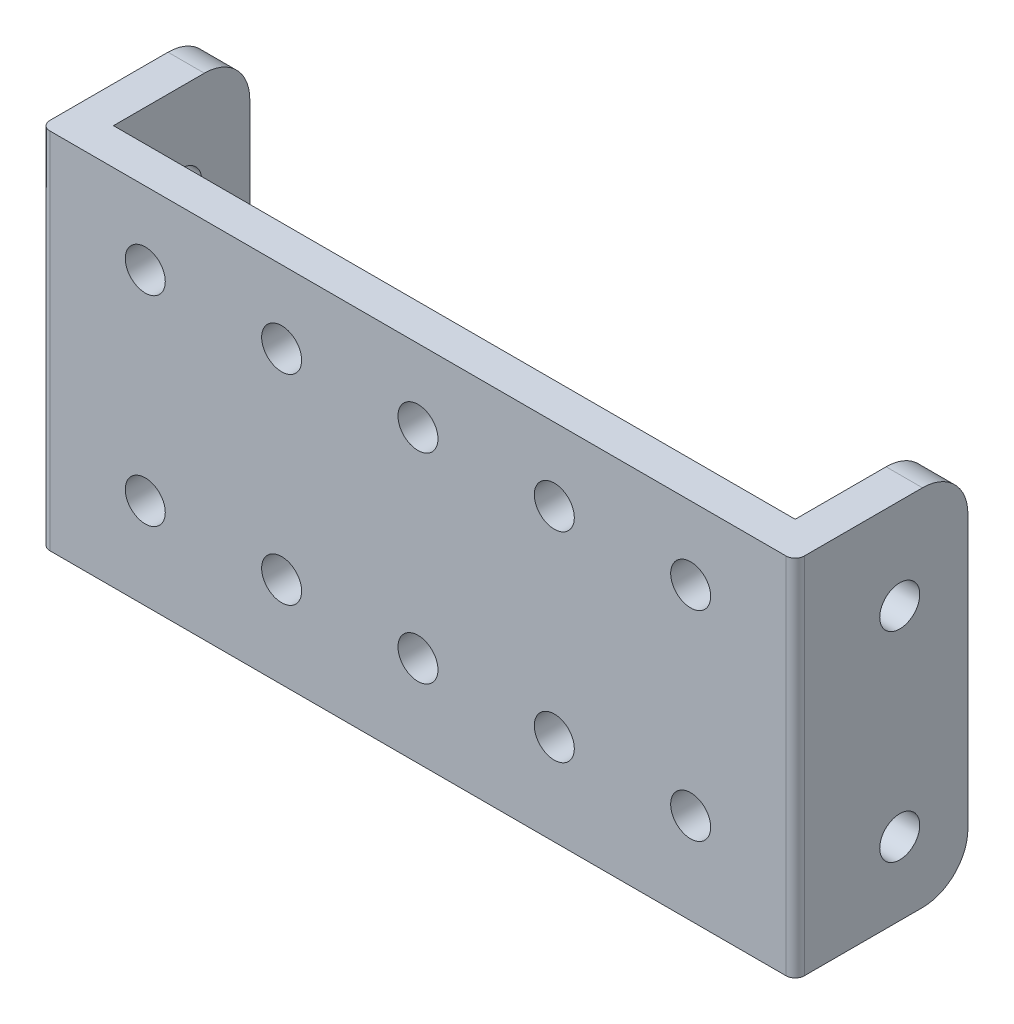
from build123d import *

# Parameters (mm, degrees)
BOSS_EXTRUDE1_DEPTH = 40
FILLET1_R           = 5
SKETCH2_R           = 2.2
CUT_EXTRUDE1_DEPTH  = 40
SKETCH3_R           = 2.2
CUT_EXTRUDE2_DEPTH  = 94


with BuildPart() as part:
    # Sketch1 → Boss-Extrude1 (new body)
    with BuildSketch(Plane(origin=(0, 0, 0), x_dir=(1, 0, 0), z_dir=(0, 1, 0))):
        with BuildLine():
            Line((36.5, 0), (-36.5, 0))
            Line((-36.5, 0), (-37.5, 0))
            Line((-37.5, 0), (-37.5, 1))
            Line((-37.5, 1), (-37.5, 15))
            Line((-37.5, 15), (-41.5, 15))
            Line((-41.5, 15), (-41.5, -3))
            ThreePointArc((-41.5, -3), (-41.207106781, -3.707106781), (-40.5, -4))
            Line((-40.5, -4), (40.5, -4))
            ThreePointArc((40.5, -4), (41.207106781, -3.707106781), (41.5, -3))
            Line((41.5, -3), (41.5, 15))
            Line((41.5, 15), (37.5, 15))
            Line((37.5, 15), (37.5, 1))
            Line((37.5, 1), (37.5, 0))
            Line((37.5, 0), (36.5, 0))
        make_face()
    extrude(amount=BOSS_EXTRUDE1_DEPTH)

    # Fillet1
    fillet1_edges = [part.edges().sort_by_distance(p)[0] for p in [
        (39.5, 0, -15),
        (-39.5, 0, -15),
        (39.5, 40, -15),
        (-39.5, 40, -15),
    ]]
    fillet(fillet1_edges, radius=FILLET1_R)

    # Sketch2 → Cut-Extrude1 (cut)
    with BuildSketch(Plane.XY.offset(4)):
        with Locations((-30, 32)):
            Circle(SKETCH2_R)
        with Locations((-15, 32)):
            Circle(SKETCH2_R)
        with Locations((0, 32)):
            Circle(SKETCH2_R)
        with Locations((15, 32)):
            Circle(SKETCH2_R)
        with Locations((30, 32)):
            Circle(SKETCH2_R)
        with Locations((-30, 10)):
            Circle(SKETCH2_R)
        with Locations((-15, 10)):
            Circle(SKETCH2_R)
        with Locations((0, 10)):
            Circle(SKETCH2_R)
        with Locations((15, 10)):
            Circle(SKETCH2_R)
        with Locations((30, 10)):
            Circle(SKETCH2_R)
    extrude(amount=-CUT_EXTRUDE1_DEPTH, mode=Mode.SUBTRACT)

    # Sketch3 → Cut-Extrude2 (cut)
    with BuildSketch(Plane.ZY.offset(41.5)):
        with Locations((-7.5, 30)):
            Circle(SKETCH3_R)
        with Locations((-7.5, 8)):
            Circle(SKETCH3_R)
    extrude(amount=-CUT_EXTRUDE2_DEPTH, mode=Mode.SUBTRACT)


solid = part.part
